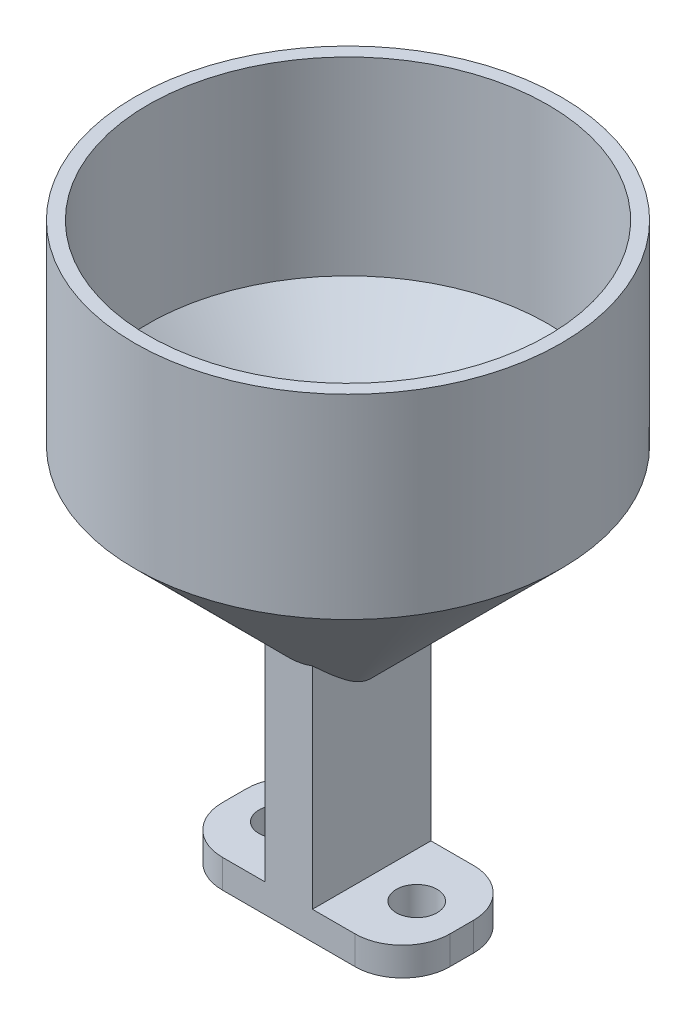
from build123d import *

# Parameters (mm, degrees)
SKETCH1_R           = 2.15
BOSS_EXTRUDE1_DEPTH = 1.5
SKETCH3_W           = 5
SKETCH3_H           = 20
BOSS_EXTRUDE3_DEPTH = 12.5
BOSS_EXTRUDE4_REACH = 52.014


with BuildPart() as part:
    # Sketch1 → Boss-Extrude1 (new, symmetric)
    with BuildSketch(Plane(origin=(0, 0, 0), x_dir=(1, 0, 0), z_dir=(0, 1, 0))):
        with BuildLine():
            Line((-7, -6.25), (7, -6.25))
            ThreePointArc((7, -6.25), (10.535533906, -4.785533906), (12, -1.25))
            Line((12, -1.25), (12, 1.25))
            ThreePointArc((12, 1.25), (10.535533906, 4.785533906), (7, 6.25))
            Line((7, 6.25), (-7, 6.25))
            ThreePointArc((-7, 6.25), (-10.535533906, 4.785533906), (-12, 1.25))
            Line((-12, 1.25), (-12, -1.25))
            ThreePointArc((-12, -1.25), (-10.535533906, -4.785533906), (-7, -6.25))
        make_face()
        with Locations(Location((-7.25, 0, 0), (0, 0, 270))):
            Circle(SKETCH1_R, mode=Mode.SUBTRACT)
        with Locations(Location((7.25, 0, 0), (0, 0, 270))):
            Circle(SKETCH1_R, mode=Mode.SUBTRACT)
    extrude(amount=BOSS_EXTRUDE1_DEPTH, both=True)

    # Sketch3 → Boss-Extrude3 (add)
    with BuildSketch(Plane.XY.offset(6.25)):
        with Locations((0, 11.5)):
            Rectangle(SKETCH3_W, SKETCH3_H)
    extrude(amount=-BOSS_EXTRUDE3_DEPTH)

    # Sketch4 → Revolve1 (revolve)
    with BuildSketch(Plane.XY, mode=Mode.PRIVATE) as revolve1_sk:
        Polygon((-2.5, 19.5), (-22.5, 39.5), (-22.5, 60.085786438), (-21.085786438, 60.085786438), (-21.085786438, 40.085786438), (-2.5, 21.5), (0, 21.5), (0, 19.5), align=None)
    revolve(revolve1_sk.sketch.rotate(Axis((0, 0, 0), (0, 1, 0)), 56.251031305), axis=Axis((0, 0, 0), (0, 1, 0)))

    # Sketch5 → Boss-Extrude4 (add, up to next)
    with BuildSketch(Plane(origin=(0, 21.5, 0), x_dir=(1, 0, 0), z_dir=(0, 1, 0)), mode=Mode.PRIVATE) as boss_extrude4_sk1:
        with BuildLine():
            Line((2.5, -6.25), (2.5, -3.741657387))
            ThreePointArc((2.5, -3.741657387), (0, -4.5), (-2.5, -3.741657387))
            Line((-2.5, -3.741657387), (-2.5, -6.25))
            Line((-2.5, -6.25), (2.5, -6.25))
        make_face()
    boss_extrude4_tool1 = extrude(boss_extrude4_sk1.sketch, amount=BOSS_EXTRUDE4_REACH, mode=Mode.PRIVATE) - part.part
    # Sketch5 → Boss-Extrude4 (add, up to next)
    with BuildSketch(Plane(origin=(0, 21.5, 0), x_dir=(1, 0, 0), z_dir=(0, 1, 0)), mode=Mode.PRIVATE) as boss_extrude4_sk2:
        with BuildLine():
            Line((-2.5, 6.25), (-2.5, 3.741657387))
            ThreePointArc((-2.5, 3.741657387), (0, 4.5), (2.5, 3.741657387))
            Line((2.5, 3.741657387), (2.5, 6.25))
            Line((2.5, 6.25), (-2.5, 6.25))
        make_face()
    boss_extrude4_tool2 = extrude(boss_extrude4_sk2.sketch, amount=BOSS_EXTRUDE4_REACH, mode=Mode.PRIVATE) - part.part
    add(boss_extrude4_tool1.solids().sort_by_distance((0, 21.5, 5.24074))[0])
    add(boss_extrude4_tool2.solids().sort_by_distance((0, 21.5, -5.24074))[0])


solid = part.part
